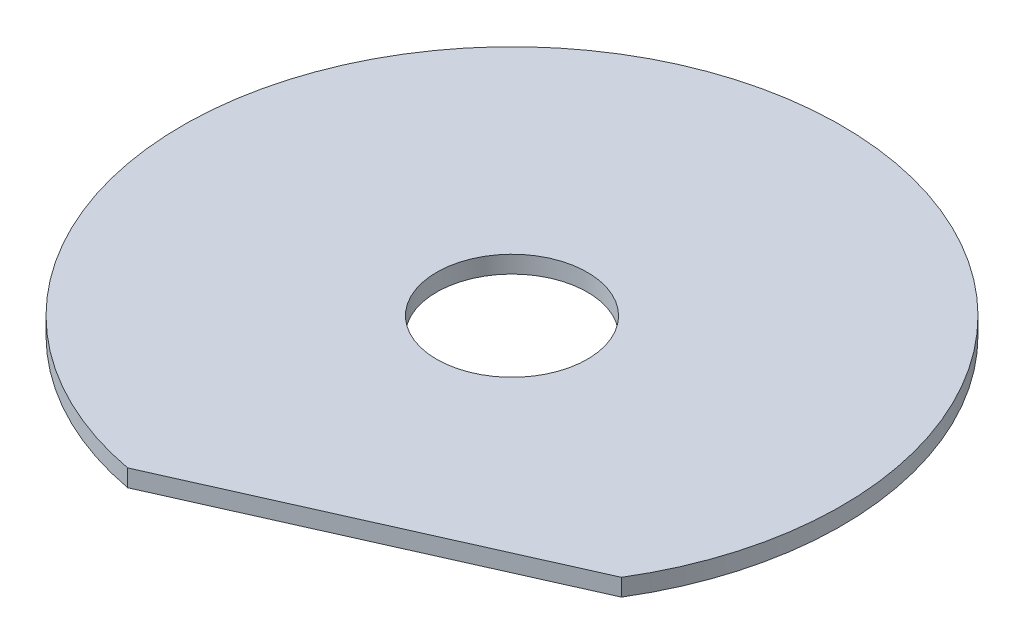
from build123d import *

# Parameters (mm, degrees)
SKETCH5_R           = 18.9865
BOSS_EXTRUDE3_DEPTH = 0.9906
SKETCH6_R           = 4.3434
CUT_EXTRUDE2_DEPTH  = 27.869232458
CUT_EXTRUDE3_DEPTH  = 27.869232458


with BuildPart() as part:
    # Sketch5 → Boss-Extrude3 (new body)
    with BuildSketch(Plane(origin=(0, 0, 0), x_dir=(1, 0, 0), z_dir=(0, 1, 0))):
        with Locations(Location((0, 0, 0), (0, 0, 270))):
            Circle(SKETCH5_R)
    extrude(amount=BOSS_EXTRUDE3_DEPTH)

    # Sketch6 → Cut-Extrude2 (cut, through all)
    with BuildSketch(Plane(origin=(0, 0.9906, 0), x_dir=(1, 0, 0), z_dir=(0, 1, 0))):
        with Locations(Location((0, 0, 0), (0, 0, 270))):
            Circle(SKETCH6_R)
    extrude(amount=-CUT_EXTRUDE2_DEPTH, mode=Mode.SUBTRACT)

    # Sketch7 → Cut-Extrude3 (cut, through all)
    with BuildSketch(Plane(origin=(0, 0.9906, 0), x_dir=(1, 0, 0), z_dir=(0, 1, 0))):
        with BuildLine():
            Line((-3.48206546, -18.664468982), (16.20193564, -9.898710207))
            ThreePointArc((16.20193564, -9.898710207), (7.723885426, -17.344416282), (-3.48206546, -18.664468982))
        make_face()
    extrude(amount=-CUT_EXTRUDE3_DEPTH, mode=Mode.SUBTRACT)


solid = part.part
